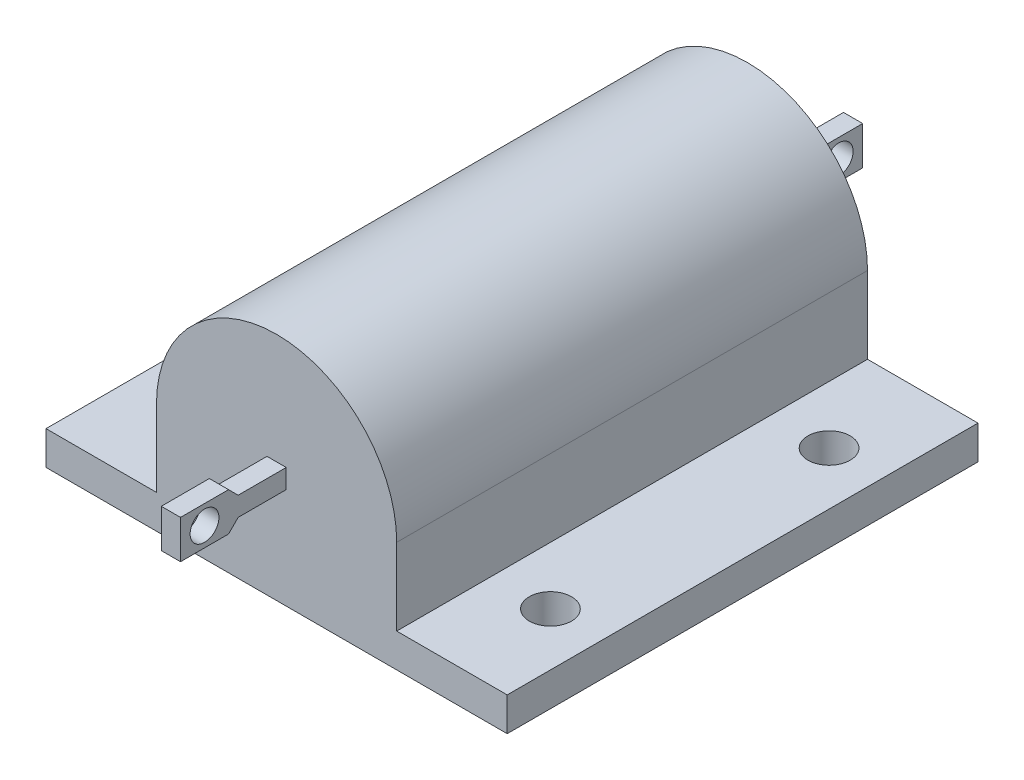
from build123d import *

# Parameters (mm, degrees)
BOSS_EXTRUDE1_DEPTH = 24.5
SKETCH2_R           = 2.2
CUT_EXTRUDE1_DEPTH  = 40.956226048
SKETCH3_R           = 1.5
BOSS_EXTRUDE2_DEPTH = 1


with BuildPart() as part:
    # Sketch1 → Boss-Extrude1 (new, symmetric)
    with BuildSketch(Plane.XY):
        with BuildLine():
            Line((12.5, -8), (24, -8))
            Line((24, -8), (24, -11.5))
            Line((24, -11.5), (-24, -11.5))
            Line((-24, -11.5), (-24, -8))
            Line((-24, -8), (-12.5, -8))
            Line((-12.5, -8), (-12.5, 0))
            ThreePointArc((-12.5, 0), (0, 12.5), (12.5, 0))
            Line((12.5, 0), (12.5, -8))
        make_face()
    extrude(amount=BOSS_EXTRUDE1_DEPTH, both=True)

    # Sketch2 → Cut-Extrude1 (cut, through all)
    with BuildSketch(Plane(origin=(0, -8, 0), x_dir=(1, 0, 0), z_dir=(0, 1, 0))):
        with Locations(Location((-18.5, 14.5, 0), (0, 0, 270))):
            Circle(SKETCH2_R)
        with Locations(Location((-18.5, -14.5, 0), (0, 0, 270))):
            Circle(SKETCH2_R)
        with Locations(Location((18.5, -14.5, 0), (0, 0, 270))):
            Circle(SKETCH2_R)
        with Locations(Location((18.5, 14.5, 0), (0, 0, 270))):
            Circle(SKETCH2_R)
    extrude(amount=-CUT_EXTRUDE1_DEPTH, mode=Mode.SUBTRACT)

    # Sketch3 → Boss-Extrude2 (add, symmetric)
    # profile 1 of 2: a face of its own
    with BuildSketch(Plane(origin=(0, 0, 0), x_dir=(0, 0, -1), z_dir=(1, 0, 0))):
        Polygon((-29.5, -1), (-24.5, -1), (-24.5, 1), (-29.5, 1), (-30.5, 2), (-35.5, 2), (-35.5, -2), (-30.5, -2), align=None)
        with Locations((-33, 0)):
            Circle(SKETCH3_R, mode=Mode.SUBTRACT)
    # profile 2 of 2: a face of its own
    with BuildSketch(Plane(origin=(0, 0, 0), x_dir=(0, 0, -1), z_dir=(1, 0, 0))):
        Polygon((24.5, -1), (24.5, 1), (29.5, 1), (30.5, 2), (35.5, 2), (35.5, -2), (30.5, -2), (29.5, -1), align=None)
        with Locations((33, 0)):
            Circle(SKETCH3_R, mode=Mode.SUBTRACT)
    extrude(amount=BOSS_EXTRUDE2_DEPTH, both=True)


solid = part.part
